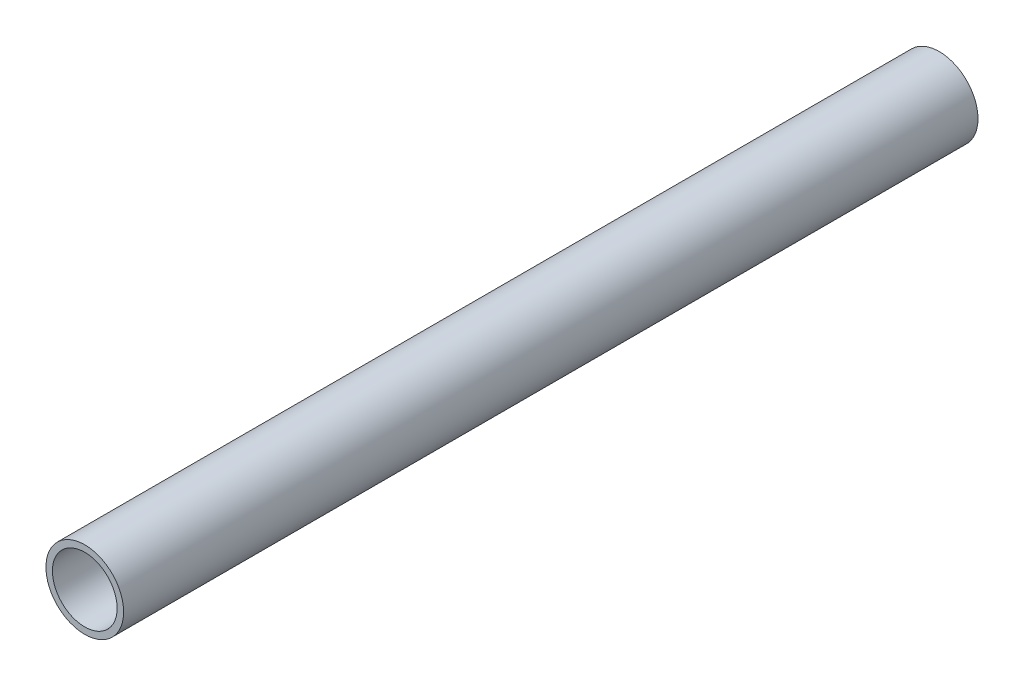
from build123d import *

# Parameters (mm, degrees)
SKETCH1_R                   = 4.7625
SKETCH1_R_2                 = 3.2004
BOSS_EXTRUDE1_DEPTH         = 104.775
F_3_8_16_TAPPED_HOLE2_D     = 7.9375
F_3_8_16_TAPPED_HOLE2_DEPTH = 23.876
F_3_8_16_TAPPED_HOLE2_TIP   = 2.384665582


with BuildPart() as part:
    # Sketch1 → Boss-Extrude1 (new body)
    with BuildSketch(Plane.XY):
        with Locations((-20.256632663, 12.355623707)):
            Circle(SKETCH1_R)
        with Locations((-20.256632663, 12.355623707)):
            Circle(SKETCH1_R_2, mode=Mode.SUBTRACT)
    extrude(amount=BOSS_EXTRUDE1_DEPTH)

    # 3/8-16 Tapped Hole2
    with Locations(Plane.XY.offset(104.775)):
        with Locations((-20.256632663, 12.355623707)):
            Hole(F_3_8_16_TAPPED_HOLE2_D / 2, depth=F_3_8_16_TAPPED_HOLE2_DEPTH)
            with Locations((0, 0, -(F_3_8_16_TAPPED_HOLE2_DEPTH + F_3_8_16_TAPPED_HOLE2_TIP / 2))):  # 118° drill point
                Cone(0, F_3_8_16_TAPPED_HOLE2_D / 2, F_3_8_16_TAPPED_HOLE2_TIP, mode=Mode.SUBTRACT)


solid = part.part
